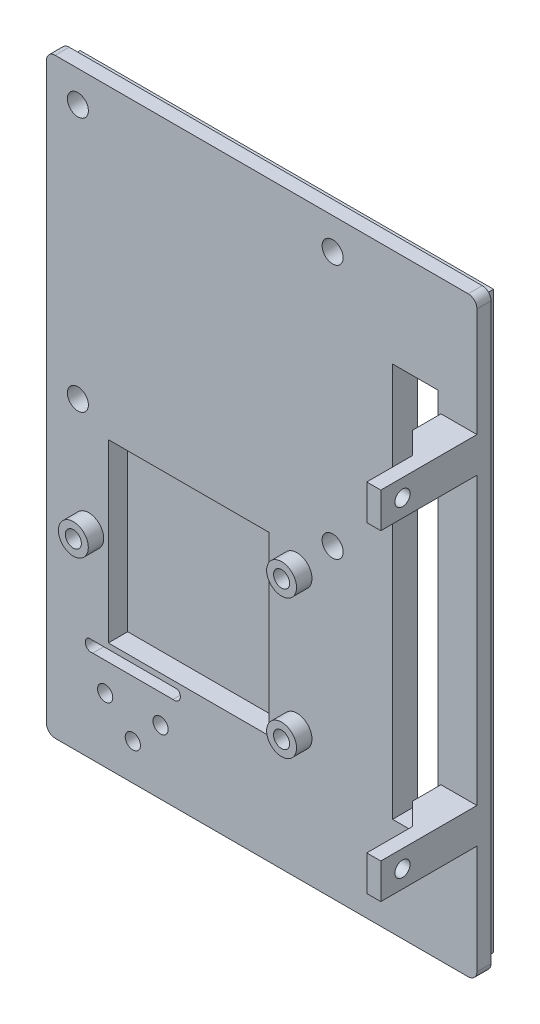
from build123d import *

# Parameters (mm, degrees)
BOSS_EXTRUDE1_DEPTH      = 2.54
SKETCH2_W                = 74.651204731
SKETCH2_H                = 103.727
BOSS_EXTRUDE2_DEPTH      = 2
CAMERA_RIBBON_HOLE_DEPTH = 4.54
SKETCH4_W                = 29
SKETCH4_H                = 31.8
RFD900_HOLE_DEPTH        = 3.5
SKETCH5_R                = 2.7
SKETCH5_R_2              = 1.45
RFD900_MOUNT_DEPTH       = 2.784999988
WIRE_START               = -2
SKETCH6_W                = 8.202097681
SKETCH6_H                = 71.209120783
WIRE_HOLE_DEPTH          = 4.54
SKETCH7_W                = 6.492515401
SKETCH7_H                = 6.35
BOSS_EXTRUDE4_DEPTH      = 17.36
CUT_EXTRUDE4_REACH       = 300.389
SKETCH13_R               = 1.375000001
CUT_EXTRUDE7_DEPTH       = 2.535264343
CUT_EXTRUDE6_START       = -4.54
SKETCH12_R               = 1.45
CUT_EXTRUDE6_DEPTH       = 4.54
SKETCH15_R               = 1.9
CUT_EXTRUDE8_DEPTH       = 4.54
SKETCH16_R               = 1.375
CUT_EXTRUDE9_DEPTH       = 4.54


with BuildPart() as part:
    # Sketch1 → Boss-Extrude1 (new body)
    with BuildSketch(Plane.XY):
        with BuildLine():
            Line((209.003679248, -17.464278872), (283.585283979, -17.464278872))
            ThreePointArc((283.585283979, -17.464278872), (284.698835738, -17.925527113), (285.160083979, -19.039078872))
            Line((285.160083979, -19.039078872), (285.160083979, -122.696478872))
            ThreePointArc((285.160083979, -122.696478872), (284.698835738, -123.810030631), (283.585283979, -124.271278872))
            Line((283.585283979, -124.271278872), (209.003679248, -124.271278872))
            ThreePointArc((209.003679248, -124.271278872), (207.890127489, -123.810030631), (207.428879248, -122.696478872))
            Line((207.428879248, -122.696478872), (207.428879248, -19.039078872))
            ThreePointArc((207.428879248, -19.039078872), (207.890127489, -17.925527113), (209.003679248, -17.464278872))
        make_face()
    extrude(amount=BOSS_EXTRUDE1_DEPTH)

    # Sketch2 → Boss-Extrude2 (add)
    with BuildSketch(Plane(origin=(0, 0, 0), x_dir=(-1, 0, 0), z_dir=(0, 0, -1))):
        with Locations((-246.294481614, -70.867778872)):
            Rectangle(SKETCH2_W, SKETCH2_H)
    extrude(amount=BOSS_EXTRUDE2_DEPTH)

    # Sketch3 → Camera Ribbon Hole (cut)
    with BuildSketch(Plane.XY.offset(2.54)):
        with BuildLine():
            Line((214.972517673, -105.55645249), (231.085240907, -105.55645249))
            ThreePointArc((231.085240907, -105.55645249), (231.52887929, -106.906363326), (230.265368958, -107.55645249))
            Line((230.265368958, -107.55645249), (215.792389622, -107.55645249))
            ThreePointArc((215.792389622, -107.55645249), (214.52887929, -106.906363326), (214.972517673, -105.55645249))
        make_face()
    extrude(amount=-CAMERA_RIBBON_HOLE_DEPTH, mode=Mode.SUBTRACT)

    # Sketch4 → RFD900 Hole (cut)
    with BuildSketch(Plane.XY.offset(2.54)):
        with Locations((233.09754244, -88.65645249)):
            Rectangle(SKETCH4_W, SKETCH4_H)
    extrude(amount=-RFD900_HOLE_DEPTH, mode=Mode.SUBTRACT)

    # Sketch5 → RFD900 Mount (add)
    # profile 1 of 3: a face of its own
    with BuildSketch(Plane.XY.offset(2.54)):
        with Locations(Location((215.071008708, -88.65645249, 0), (0, 0, 180))):
            Circle(SKETCH5_R)
        with Locations((215.071008708, -88.65645249)):
            Circle(SKETCH5_R_2, mode=Mode.SUBTRACT)
    # profile 2 of 3: a face of its own
    with BuildSketch(Plane.XY.offset(2.54)):
        with Locations(Location((252.671008708, -101.20645249, 0), (0, 0, 180))):
            Circle(SKETCH5_R)
        with Locations((252.671008708, -101.20645249)):
            Circle(SKETCH5_R_2, mode=Mode.SUBTRACT)
    # profile 3 of 3: a face of its own
    with BuildSketch(Plane.XY.offset(2.54)):
        with Locations(Location((252.671008708, -76.10645249, 0), (0, 0, 180))):
            Circle(SKETCH5_R)
        with Locations((252.671008708, -76.10645249)):
            Circle(SKETCH5_R_2, mode=Mode.SUBTRACT)
    extrude(amount=RFD900_MOUNT_DEPTH)

    # Sketch6 → Wire Hole (cut)
    with BuildSketch(Plane.XY.offset(WIRE_START)):
        with Locations((274.024654874, -70.867778873)):
            Rectangle(SKETCH6_W, SKETCH6_H)
    extrude(amount=WIRE_HOLE_DEPTH, mode=Mode.SUBTRACT)

    # Sketch7 → Boss-Extrude4 (add)
    with BuildSketch(Plane.XY.offset(2.54)):
        with Locations((281.913826279, -41.867778872)):
            Rectangle(SKETCH7_W, SKETCH7_H)
        with Locations((281.913826279, -99.867778872)):
            Rectangle(SKETCH7_W, SKETCH7_H)
    extrude(amount=BOSS_EXTRUDE4_DEPTH)

    # Cut-Extrude4: up to this face of the body (flat: up to its plane)
    cut_extrude4_end = Plane(part.part.faces().sort_by_distance((281.913826279, -38.692778872, 11.22))[0])
    # Sketch8 → Cut-Extrude4 (cut, up to the picked face)
    with BuildSketch(Plane.XZ.offset(103.042778872), mode=Mode.PRIVATE) as cut_extrude4_sk1:
        Polygon((282.624819635, 11.684999999), (278.667568578, 7.727748942), (278.667568578, 19.9), (282.624819635, 19.9), (282.624819635, 16.98), (282.624819635, 14.604999999), align=None)
    cut_extrude4_tool1 = split(extrude(cut_extrude4_sk1.sketch, amount=-CUT_EXTRUDE4_REACH, mode=Mode.PRIVATE), bisect_by=cut_extrude4_end, keep=Keep.BOTH, mode=Mode.PRIVATE)
    add(cut_extrude4_tool1.solids().sort_by(Axis((280.518174, -103.042779, 14.739177), (0, 1, 0)))[0], mode=Mode.SUBTRACT)

    # Sketch13 → Cut-Extrude7 (cut)
    with BuildSketch(Plane(origin=(285.160083979, 0, 0), x_dir=(0, 0, -1), z_dir=(1, 0, 0))):
        with Locations((-15.98, -99.867778872)):
            Circle(SKETCH13_R)
        with Locations((-15.98, -41.867778872)):
            Circle(SKETCH13_R)
    extrude(amount=-CUT_EXTRUDE7_DEPTH, mode=Mode.SUBTRACT)

    # Sketch12 → Cut-Extrude6 (cut)
    with BuildSketch(Plane.XY.offset(2.54).offset(CUT_EXTRUDE6_START)):
        with Locations(Location((252.671008708, -76.10645249, 0), (0, 0, 180))):
            Circle(SKETCH12_R)
        with Locations(Location((252.671008708, -101.20645249, 0), (0, 0, 180))):
            Circle(SKETCH12_R)
        with Locations(Location((215.071008708, -88.65645249, 0), (0, 0, 180))):
            Circle(SKETCH12_R)
    extrude(amount=CUT_EXTRUDE6_DEPTH, mode=Mode.SUBTRACT)

    # Sketch15 → Cut-Extrude8 (cut)
    with BuildSketch(Plane.XY.offset(2.54)):
        with Locations((213.103879248, -23.139278872)):
            Circle(SKETCH15_R)
        with Locations((259.103879248, -23.139278872)):
            Circle(SKETCH15_R)
        with Locations((213.103879248, -69.139278872)):
            Circle(SKETCH15_R)
        with Locations((259.103879248, -69.139278872)):
            Circle(SKETCH15_R)
    extrude(amount=-CUT_EXTRUDE8_DEPTH, mode=Mode.SUBTRACT)

    # Sketch16 → Cut-Extrude9 (cut)
    with BuildSketch(Plane.XY.offset(2.54)):
        with Locations((228.028879248, -112.696478872)):
            Circle(SKETCH16_R)
        with Locations((223.028879248, -117.696478872)):
            Circle(SKETCH16_R)
        with Locations((218.028879248, -112.696478872)):
            Circle(SKETCH16_R)
    extrude(amount=-CUT_EXTRUDE9_DEPTH, mode=Mode.SUBTRACT)


solid = part.part
